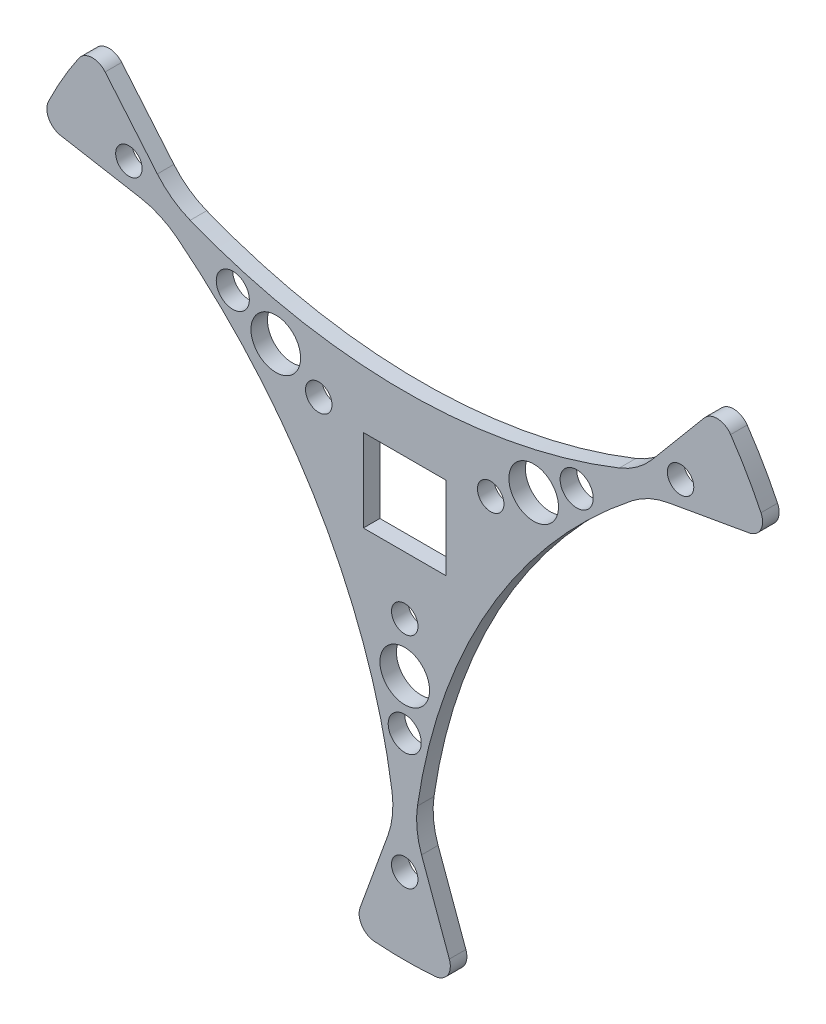
from build123d import *

# Parameters (mm, degrees)
SKETCH_1_R          = 47.75
EXTRUDE_1_DEPTH     = 2
SKETCH_2_R          = 1.6
CUT_EXTRUDE_1_DEPTH = 68.558308149
FILLET_1_R          = 10
SKETCH_3_R          = 1.6
SKETCH_3_R_2        = 3
SKETCH_3_R_3        = 2
SKETCH_3_W          = 10
SKETCH_3_H          = 10
CUT_EXTRUDE_2_DEPTH = 66.049417533
FILLET_2_R          = 2


with BuildPart() as part:
    # ｽｹｯﾁ1 → ﾎﾞｽ - 押し出し1 (new body)
    with BuildSketch(Plane.XY):
        Circle(SKETCH_1_R)
    extrude(amount=EXTRUDE_1_DEPTH)

    # ｽｹｯﾁ2 → ｶｯﾄ - 押し出し1 (cut, through all)
    with BuildSketch(Plane.XY.offset(2)):
        with Locations((0, -38.5)):
            Circle(SKETCH_2_R)
        with Locations((-33.341978046, 19.25)):
            Circle(SKETCH_2_R)
        with Locations((33.341978046, 19.25)):
            Circle(SKETCH_2_R)
        with BuildLine():
            Line((-44.128949923, 18.240018604), (-29.553612406, 15.669993347))
            ThreePointArc((-29.553612406, 15.669993347), (-10.20639232, -5.892663354), (-1.206193887, -33.429175791))
            Line((-1.206193887, -33.429175791), (-6.268155485, -47.336800978))
            ThreePointArc((-6.268155485, -47.336800978), (-41.352713031, -23.875), (-44.128949923, 18.240018604))
        make_face()
        with BuildLine():
            Line((6.268155485, -47.336800978), (1.206193887, -33.429175791))
            ThreePointArc((1.206193887, -33.429175791), (10.20639232, -5.892663354), (29.553612406, 15.669993347))
            Line((29.553612406, 15.669993347), (44.128949923, 18.240018604))
            ThreePointArc((44.128949923, 18.240018604), (41.352713031, -23.875), (6.268155485, -47.336800978))
        make_face()
        with BuildLine():
            Line((-37.860794438, 29.096782374), (-28.347418519, 17.759182444))
            ThreePointArc((-28.347418519, 17.759182444), (0, 11.785326707), (28.347418519, 17.759182444))
            Line((28.347418519, 17.759182444), (37.860794438, 29.096782374))
            ThreePointArc((37.860794438, 29.096782374), (0, 47.75), (-37.860794438, 29.096782374))
        make_face()
    extrude(amount=-CUT_EXTRUDE_1_DEPTH, mode=Mode.SUBTRACT)

    # ﾌｨﾚｯﾄ1
    fillet_1_edges = [part.edges().sort_by_distance(p)[0] for p in [
        (1.206193887, -33.429175791, 1),
        (29.553612406, 15.669993347, 1),
        (28.347418519, 17.759182444, 1),
        (-28.347418519, 17.759182444, 1),
        (-29.553612406, 15.669993347, 1),
        (-1.206193887, -33.429175791, 1),
    ]]
    fillet(fillet_1_edges, radius=FILLET_1_R)

    # ｽｹｯﾁ3 → ｶｯﾄ - 押し出し2 (cut, through all)
    with BuildSketch(Plane(origin=(0, 0, 0), x_dir=(-1, 0, 0), z_dir=(0, 0, -1))):
        with Locations((-10.392304845, 6)):
            Circle(SKETCH_3_R)
        with Locations((0, -12)):
            Circle(SKETCH_3_R)
        with Locations((10.392304845, 6)):
            Circle(SKETCH_3_R)
        with Locations((0, -18)):
            Circle(SKETCH_3_R_2)
        with Locations((0, -24)):
            Circle(SKETCH_3_R_3)
        with Locations((-15.588457268, 9)):
            Circle(SKETCH_3_R_2)
        with Locations((-20.784609691, 12)):
            Circle(SKETCH_3_R_3)
        with Locations((15.588457268, 9)):
            Circle(SKETCH_3_R_2)
        with Locations((20.784609691, 12)):
            Circle(SKETCH_3_R_3)
        Rectangle(SKETCH_3_W, SKETCH_3_H)
    extrude(amount=-CUT_EXTRUDE_2_DEPTH, mode=Mode.SUBTRACT)

    # ﾌｨﾚｯﾄ2
    fillet_2_edges = [part.edges().sort_by_distance(p)[0] for p in [
        (44.128949923, 18.240018604, 1),
        (6.268155485, -47.336800978, 1),
        (-37.860794438, 29.096782374, 1),
        (37.860794438, 29.096782374, 1),
        (-6.268155485, -47.336800978, 1),
        (-44.128949923, 18.240018604, 1),
    ]]
    fillet(fillet_2_edges, radius=FILLET_2_R)


solid = part.part
